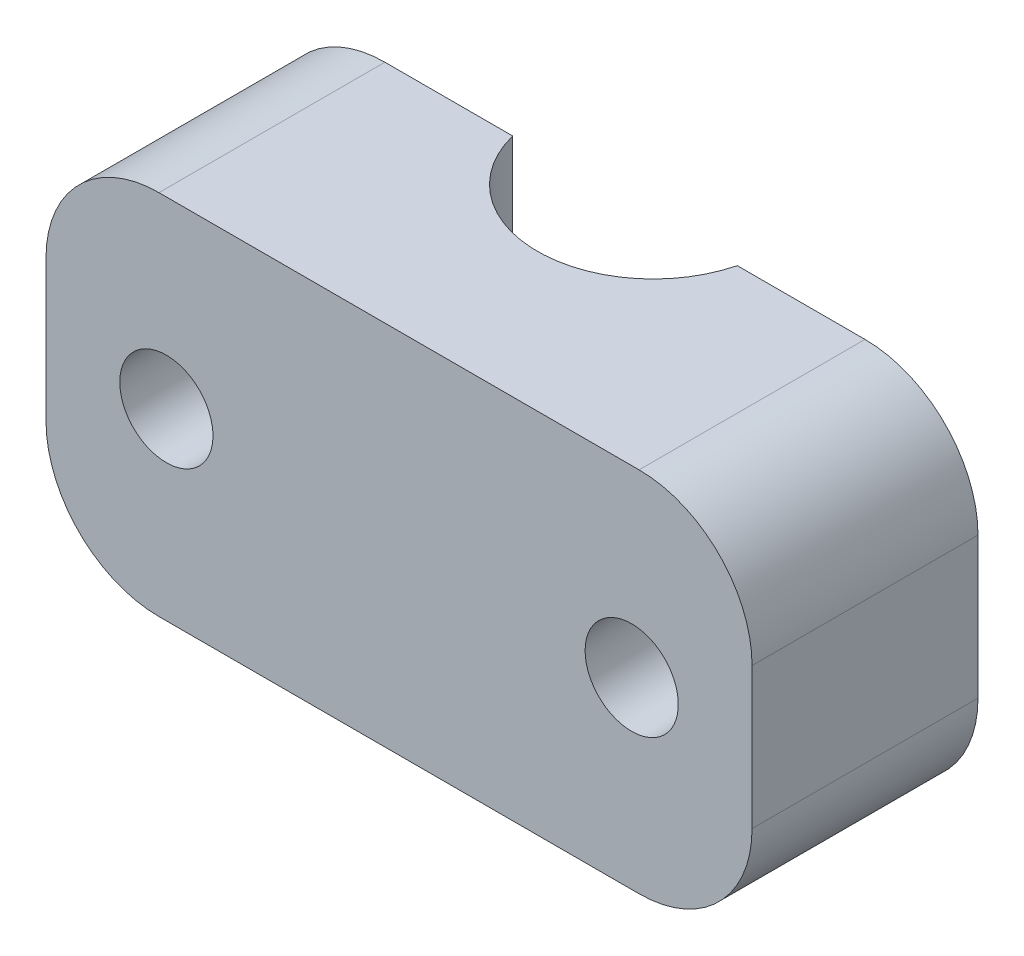
from build123d import *

# Parameters (mm, degrees)
SKETCH1_W           = 25
SKETCH1_H           = 8
BOSS_EXTRUDE1_DEPTH = 13
SKETCH2_R           = 4.1
CUT_EXTRUDE1_DEPTH  = 19.472953202
SKETCH3_R           = 1.65
CUT_EXTRUDE2_DEPTH  = 10
FILLET2_R           = 4


with BuildPart() as part:
    # Sketch1 → Boss-Extrude1 (new body)
    with BuildSketch(Plane(origin=(0, 0, 0), x_dir=(1, 0, 0), z_dir=(0, 1, 0))):
        Rectangle(SKETCH1_W, SKETCH1_H)
    extrude(amount=BOSS_EXTRUDE1_DEPTH)

    # Sketch2 → Cut-Extrude1 (cut, through all)
    with BuildSketch(Plane(origin=(0, 13, 0), x_dir=(1, 0, 0), z_dir=(0, 1, 0))):
        with Locations((0, 5)):
            Circle(SKETCH2_R)
    extrude(amount=-CUT_EXTRUDE1_DEPTH, mode=Mode.SUBTRACT)

    # Sketch3 → Cut-Extrude2 (cut)
    with BuildSketch(Plane(origin=(0, 0, -4), x_dir=(-1, 0, 0), z_dir=(0, 0, -1))):
        with Locations((8.238089535, 6.5)):
            Circle(SKETCH3_R)
        with Locations((-8.238089535, 6.5)):
            Circle(SKETCH3_R)
    extrude(amount=-CUT_EXTRUDE2_DEPTH, mode=Mode.SUBTRACT)

    # Fillet2
    fillet2_edges = [part.edges().sort_by_distance(p)[0] for p in [
        (-12.5, 13, 0),
        (12.5, 13, 0),
        (-12.5, 0, 0),
        (12.5, 0, 0),
    ]]
    fillet(fillet2_edges, radius=FILLET2_R)


solid = part.part
